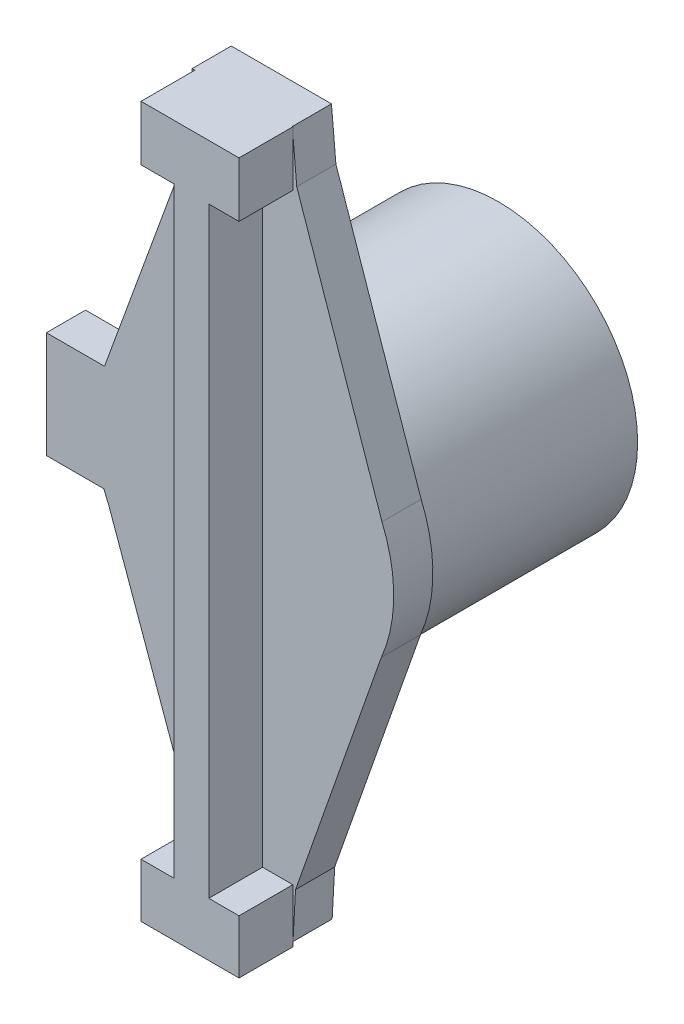
from build123d import *

# Parameters (mm, degrees)
SKETCH1_R           = 0.028406682
BOSS_EXTRUDE1_DEPTH = 0.044
BOSS_EXTRUDE2_DEPTH = 0.008
SKETCH3_W           = 0.02001877
SKETCH3_H           = 0.011245582
SKETCH3_H_2         = 0.011009053
BOSS_EXTRUDE3_DEPTH = 0.011
SKETCH4_W           = 0.007059528
SKETCH4_H           = 0.122854085
BOSS_EXTRUDE4_DEPTH = 0.011


with BuildPart() as part:
    # Sketch1 → Boss-Extrude1 (new body)
    with BuildSketch(Plane.XY):
        Circle(SKETCH1_R)
    extrude(amount=BOSS_EXTRUDE1_DEPTH)

    # Sketch2 → Boss-Extrude2 (add)
    with BuildSketch(Plane.XY.offset(0.044)):
        with BuildLine():
            Line((-0.028511858, 0.011040645), (-0.010617218, 0.060186572))
            Line((-0.010617218, 0.060186572), (-0.010617218, 0.072656083))
            Line((-0.010617218, 0.072656083), (0.009855522, 0.072656083))
            Line((0.009855522, 0.072656083), (0.01076512, 0.062438855))
            Line((0.01076512, 0.062438855), (0.028177961, 0.011866947))
            ThreePointArc((0.028177961, 0.011866947), (0.030574228, -0.000196141), (0.028023389, -0.012227493))
            Line((0.028023389, -0.012227493), (0.010514305, -0.06203853))
            Line((0.010514305, -0.06203853), (0.01, -0.071500003))
            Line((0.01, -0.071500003), (-0.01, -0.071500003))
            Line((-0.01, -0.071500003), (-0.011238314, -0.058784869))
            Line((-0.011238314, -0.058784869), (-0.027712476, -0.01291668))
            ThreePointArc((-0.027712476, -0.01291668), (-0.028200603, -0.01181304), (-0.028644799, -0.010690998))
            Line((-0.028644799, -0.010690998), (-0.040386658, -0.010690998))
            Line((-0.040386658, -0.010690998), (-0.040386658, 0.011040645))
            Line((-0.040386658, 0.011040645), (-0.028511858, 0.011040645))
        make_face()
    extrude(amount=BOSS_EXTRUDE2_DEPTH)

    # Sketch3 → Boss-Extrude3 (add)
    with BuildSketch(Plane.XY.offset(0.052)):
        with Locations((-3.9476e-05, 0.067033292)):
            Rectangle(SKETCH3_W, SKETCH3_H)
        with Locations((-3.9476e-05, -0.066948111)):
            Rectangle(SKETCH3_W, SKETCH3_H_2)
    extrude(amount=BOSS_EXTRUDE3_DEPTH)

    # Sketch4 → Boss-Extrude4 (add)
    with BuildSketch(Plane.XY.offset(0.052)):
        with Locations((0.000258562, -1.6541e-05)):
            Rectangle(SKETCH4_W, SKETCH4_H)
    extrude(amount=BOSS_EXTRUDE4_DEPTH)


solid = part.part
